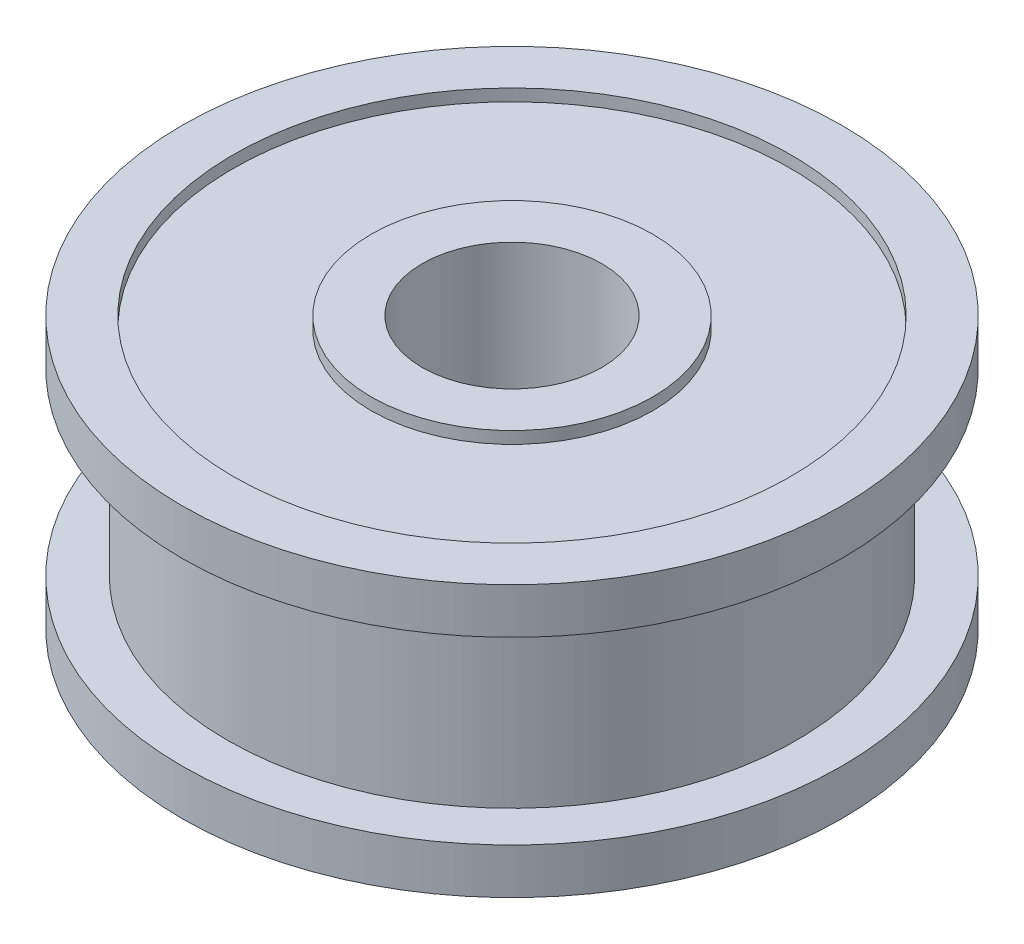
from build123d import *

# Parameters (mm, degrees)
SKETCH1_R           = 5.5
BOSS_EXTRUDE1_DEPTH = 0.76
SKETCH2_R           = 4.75
BOSS_EXTRUDE2_DEPTH = 3
SKETCH3_R           = 5.5
BOSS_EXTRUDE3_DEPTH = 0.76
SKETCH4_R           = 1.5
CUT_EXTRUDE1_DEPTH  = 4.52
SKETCH5_R           = 4.65
SKETCH5_R_2         = 2.35
CUT_EXTRUDE2_DEPTH  = 0.2
CUT_EXTRUDE3_START  = -0.2
SKETCH6_R           = 4.65
SKETCH6_R_2         = 2.35
CUT_EXTRUDE3_DEPTH  = 0.2


with BuildPart() as part:
    # Sketch1 → Boss-Extrude1 (new body)
    with BuildSketch(Plane(origin=(0, 0, 0), x_dir=(1, 0, 0), z_dir=(0, 1, 0))):
        with Locations(Location((0, 0, 0), (0, 0, 270))):
            Circle(SKETCH1_R)
    extrude(amount=BOSS_EXTRUDE1_DEPTH)

    # Sketch2 → Boss-Extrude2 (add)
    with BuildSketch(Plane(origin=(0, 0.76, 0), x_dir=(1, 0, 0), z_dir=(0, 1, 0))):
        with Locations(Location((0, 0, 0), (0, 0, 270))):
            Circle(SKETCH2_R)
    extrude(amount=BOSS_EXTRUDE2_DEPTH)

    # Sketch3 → Boss-Extrude3 (add)
    with BuildSketch(Plane(origin=(0, 3.76, 0), x_dir=(1, 0, 0), z_dir=(0, 1, 0))):
        with Locations(Location((0, 0, 0), (0, 0, 270))):
            Circle(SKETCH3_R)
    extrude(amount=BOSS_EXTRUDE3_DEPTH)

    # Sketch4 → Cut-Extrude1 (cut)
    with BuildSketch(Plane.XZ):
        with Locations(Location((0, 0, 0), (0, 0, 270))):
            Circle(SKETCH4_R)
    extrude(amount=-CUT_EXTRUDE1_DEPTH, mode=Mode.SUBTRACT)

    # Sketch5 → Cut-Extrude2 (cut)
    with BuildSketch(Plane(origin=(0, 4.52, 0), x_dir=(1, 0, 0), z_dir=(0, 1, 0))):
        with Locations(Location((0, 0, 0), (0, 0, 270))):
            Circle(SKETCH5_R)
        with Locations(Location((0, 0, 0), (0, 0, 270))):
            Circle(SKETCH5_R_2, mode=Mode.SUBTRACT)
    extrude(amount=-CUT_EXTRUDE2_DEPTH, mode=Mode.SUBTRACT)

    # Sketch6 → Cut-Extrude3 (cut)
    with BuildSketch(Plane.XZ.offset(CUT_EXTRUDE3_START)):
        with Locations(Location((0, 0, 0), (0, 0, 90))):
            Circle(SKETCH6_R)
        with Locations(Location((0, 0, 0), (0, 0, 90))):
            Circle(SKETCH6_R_2, mode=Mode.SUBTRACT)
    extrude(amount=CUT_EXTRUDE3_DEPTH, mode=Mode.SUBTRACT)


solid = part.part
